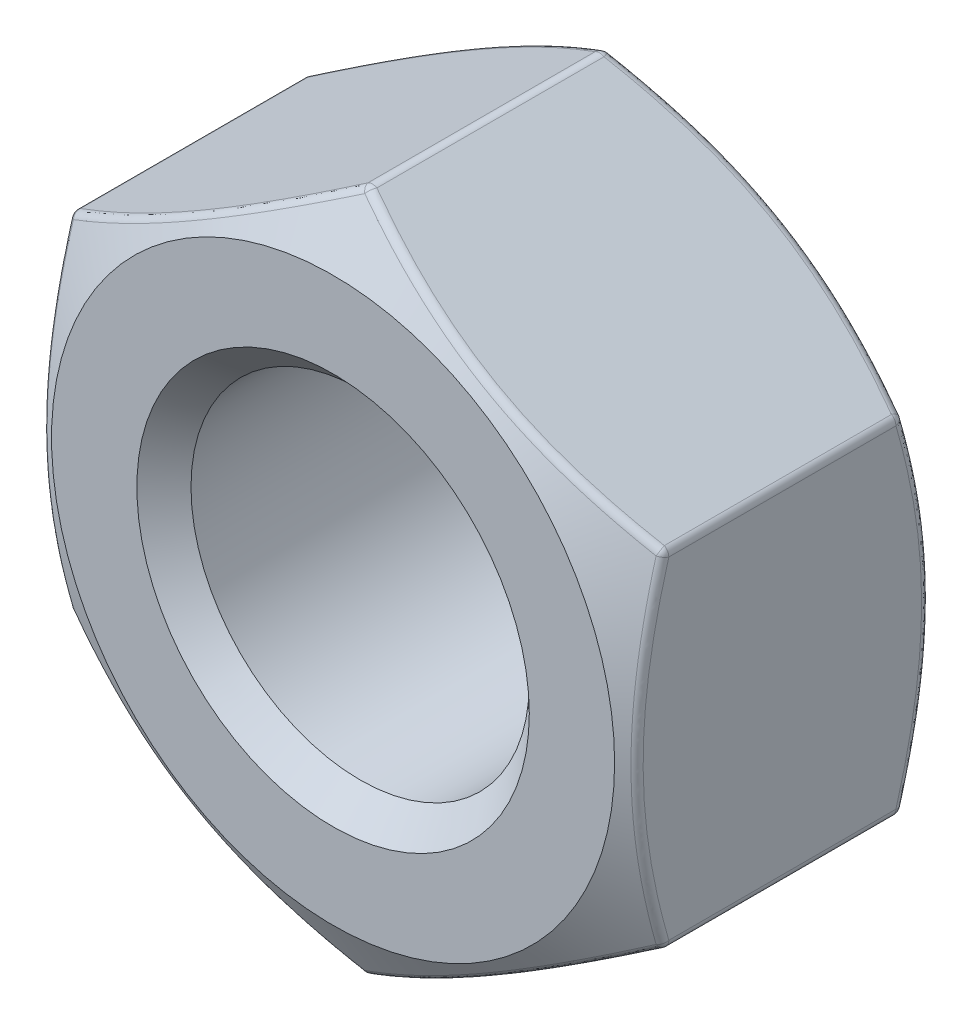
from build123d import *

# Parameters (mm, degrees)
SKETCH3_R           = 3.175
BOSS_EXTRUDE1_DEPTH = 2.8702
SKETCH4_OUTSIDE_W   = 55.7
SKETCH4_OUTSIDE_H   = 57.42
SKETCH4_OUTSIDE_R   = 5.28447
CUT_EXTRUDE1_DEPTH  = 11.254335795
CUT_EXTRUDE1_DRAFT  = -60
CUT_EXTRUDE2_START  = -5.7404
SKETCH4_2_OUTSIDE_W = 75.584
SKETCH4_2_OUTSIDE_H = 77.304
SKETCH4_2_OUTSIDE_R = 5.28447
CUT_EXTRUDE2_DEPTH  = 16.994735795
CUT_EXTRUDE2_DRAFT  = 60
FILLET1_R           = 0.166878
CHAMFER1_SIZE       = 0.508


with BuildPart() as part:
    # Sketch3 → Boss-Extrude1 (new, symmetric)
    with BuildSketch(Plane.XY):
        Polygon((0, 6.423137215), (-5.5626, 3.211568607), (-5.5626, -3.211568607), (0, -6.423137215), (5.5626, -3.211568607), (5.5626, 3.211568607), align=None)
        with Locations(Location((0, 0, 0), (0, 0, 180))):
            Circle(SKETCH3_R, mode=Mode.SUBTRACT)
    extrude(amount=BOSS_EXTRUDE1_DEPTH, both=True)


with BuildPart() as cut_extrude1_tool:
    # Sketch4 outside → Cut-Extrude1 (with draft: the straight prism first)
    with BuildSketch(Plane.XY.offset(2.8702)):
        Rectangle(SKETCH4_OUTSIDE_W, SKETCH4_OUTSIDE_H)
        Circle(SKETCH4_OUTSIDE_R, mode=Mode.SUBTRACT)
    extrude(amount=-CUT_EXTRUDE1_DEPTH)
    # Cut-Extrude1: the draft: its side faces are tilted about the plane it starts from
    cut_extrude1_sides = [cut_extrude1_tool.faces().sort_by_distance(p)[0] for p in [
        (0, -28.71, -2.756967898),
        (27.85, 0, -2.756967898),
        (0, 28.71, -2.756967898),
        (-27.85, 0, -2.756967898),
        (-5.28447, 0, -2.756967898),
    ]]
    draft(cut_extrude1_sides, Plane.XY.offset(2.8702), CUT_EXTRUDE1_DRAFT)


with BuildPart() as part_1:
    add(part.part)

    # Cut-Extrude1: cut by cut_extrude1_tool
    add(cut_extrude1_tool.part, mode=Mode.SUBTRACT)


with BuildPart() as cut_extrude2_tool:
    # Sketch4<2> outside → Cut-Extrude2 (with draft: the straight prism first)
    with BuildSketch(Plane.XY.offset(2.8702).offset(CUT_EXTRUDE2_START)):
        Rectangle(SKETCH4_2_OUTSIDE_W, SKETCH4_2_OUTSIDE_H)
        Circle(SKETCH4_2_OUTSIDE_R, mode=Mode.SUBTRACT)
    extrude(amount=CUT_EXTRUDE2_DEPTH)
    # Cut-Extrude2: the draft: its side faces are tilted about the plane it starts from
    cut_extrude2_sides = [cut_extrude2_tool.faces().sort_by_distance(p)[0] for p in [
        (0, -38.652, 5.627167898),
        (37.792, 0, 5.627167898),
        (0, 38.652, 5.627167898),
        (-37.792, 0, 5.627167898),
        (-5.28447, 0, 5.627167898),
    ]]
    draft(cut_extrude2_sides, Plane.XY.offset(2.8702).offset(CUT_EXTRUDE2_START), CUT_EXTRUDE2_DRAFT)


with BuildPart() as part_2:
    add(part_1.part)

    # Cut-Extrude2: cut by cut_extrude2_tool
    add(cut_extrude2_tool.part, mode=Mode.SUBTRACT)

    # Fillet1
    fillet1_edges = [part_2.edges().sort_by_distance(p)[0] for p in [
        (5.5626, 3.211568607, 0),
        (5.5626, -3.211568607, 0),
        (5.5626, -1.623104927, 2.575696274),
        (0, -6.423137215, 0),
        (-5.5626, -3.211568607, 0),
        (-5.5626, 3.211568607, 0),
        (0, 6.423137215, 0),
        (2.7813, 4.817352911, 2.70962157),
        (-2.7813, 4.817352911, 2.70962157),
        (-5.5626, 0, 2.70962157),
        (-2.7813, -4.817352911, 2.70962157),
        (2.7813, -4.817352911, 2.70962157),
        (5.5626, -1.623104927, -2.575696274),
        (2.7813, 4.817352911, -2.70962157),
        (-2.7813, 4.817352911, -2.70962157),
        (-5.5626, 0, -2.70962157),
        (-2.7813, -4.817352911, -2.70962157),
        (2.7813, -4.817352911, -2.70962157),
    ]]
    fillet(fillet1_edges, radius=FILLET1_R)

    # Chamfer1
    chamfer1_edges = [part_2.edges().sort_by_distance(p)[0] for p in [
        (3.175, 0, -2.8702),
        (3.175, 0, 2.8702),
    ]]
    chamfer(chamfer1_edges, length=CHAMFER1_SIZE)


solid = part_2.part
